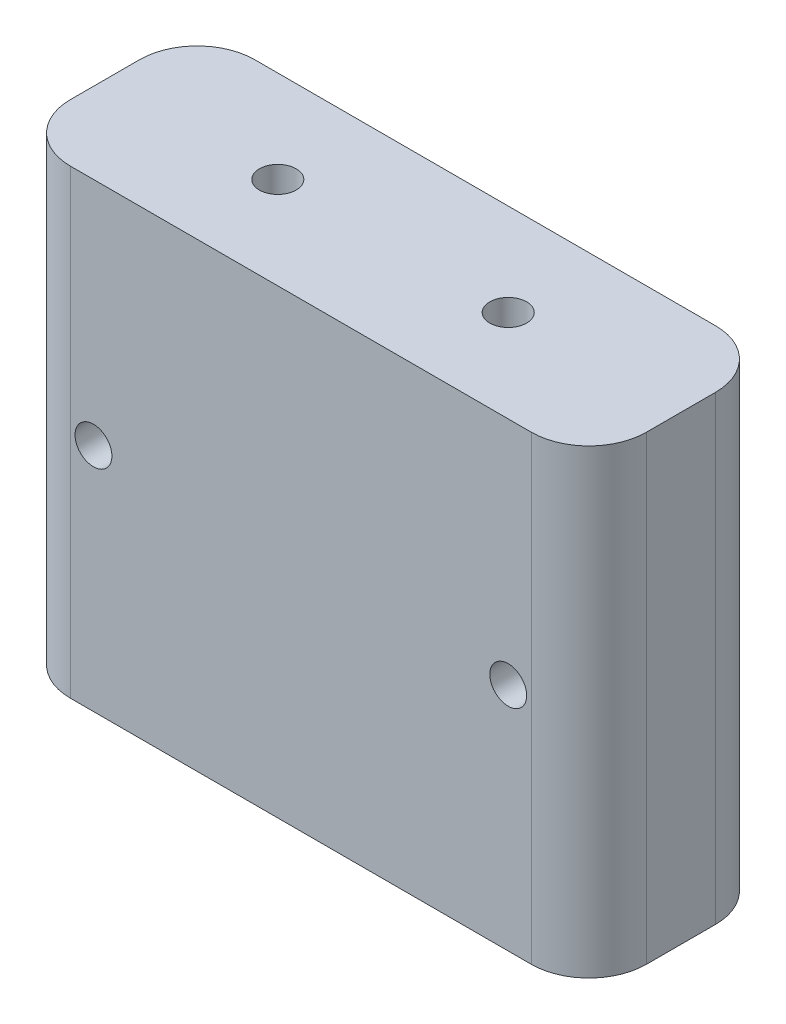
from build123d import *

# Parameters (mm, degrees)
SKETCH1_W           = 50
SKETCH1_H           = 16
SKETCH1_R           = 1.6
BOSS_EXTRUDE1_DEPTH = 40
SKETCH2_R           = 1.6
CUT_EXTRUDE1_DEPTH  = 67
FILLET1_R           = 5


with BuildPart() as part:
    # Sketch1 → Boss-Extrude1 (new body)
    with BuildSketch(Plane(origin=(0, 0, 0), x_dir=(1, 0, 0), z_dir=(0, 1, 0))):
        with Locations((25, 8)):
            Rectangle(SKETCH1_W, SKETCH1_H)
        with Locations(Location((15, 8, 0), (0, 0, 270))):
            Circle(SKETCH1_R, mode=Mode.SUBTRACT)
        with Locations(Location((35, 8, 0), (0, 0, 270))):
            Circle(SKETCH1_R, mode=Mode.SUBTRACT)
    extrude(amount=BOSS_EXTRUDE1_DEPTH)

    # Sketch2 → Cut-Extrude1 (cut, through all)
    with BuildSketch(Plane.XY):
        with Locations((7, 20)):
            Circle(SKETCH2_R)
        with Locations((43, 20)):
            Circle(SKETCH2_R)
    extrude(amount=-CUT_EXTRUDE1_DEPTH, mode=Mode.SUBTRACT)

    # Fillet1
    fillet1_edges = [part.edges().sort_by_distance(p)[0] for p in [
        (0, 20, -16),
        (50, 20, -16),
        (50, 20, 0),
        (0, 20, 0),
    ]]
    fillet(fillet1_edges, radius=FILLET1_R)


solid = part.part
